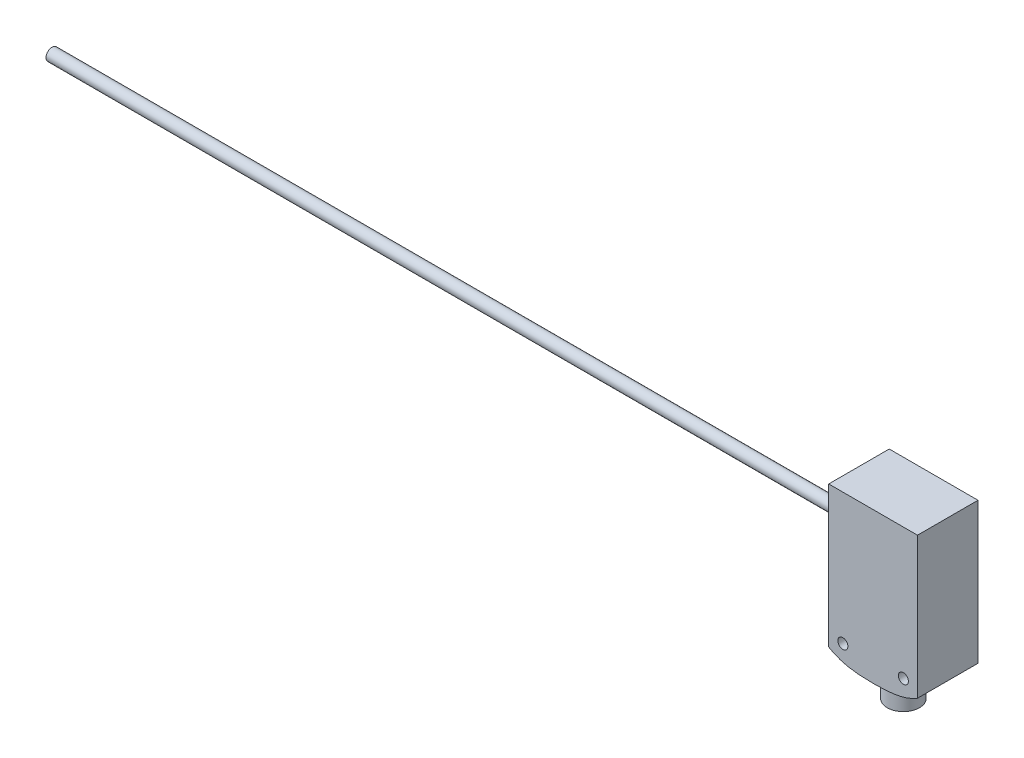
from build123d import *

# Parameters (mm, degrees)
ESQUISSE1_W             = 22
ESQUISSE1_H             = 44.3
ESQUISSE1_R             = 1.25
BOSS_EXTRU_1_DEPTH      = 15
ENL_V_MAT_EXTRU_1_DEPTH = 49.046748069
BOSS_EXTRU_2_REACH      = 50.047
ESQUISSE3_R             = 4
ENL_V_MAT_EXTRU_2_DEPTH = 0.1
ESQUISSE5_R             = 1.5
BOSS_EXTRU_3_DEPTH      = 200


with BuildPart() as part:
    # Esquisse1 → Boss.-Extru.1 (new body)
    with BuildSketch(Plane.XY):
        with Locations((0, 22.15)):
            Rectangle(ESQUISSE1_W, ESQUISSE1_H)
        with Locations((7.5, 11.8)):
            Circle(ESQUISSE1_R, mode=Mode.SUBTRACT)
        with Locations(Location((-7.5, 11.8, 0), (0, 0, 180))):
            Circle(ESQUISSE1_R, mode=Mode.SUBTRACT)
    extrude(amount=BOSS_EXTRU_1_DEPTH)

    # Esquisse2 → Enlèv. mat.-Extru.1 (cut, through all)
    with BuildSketch(Plane.XY.offset(15)):
        with BuildLine():
            Line((-11, 9.3), (-11, 0))
            Line((-11, 0), (11, 0))
            Line((11, 0), (11, 9.3))
            add(Edge.make_bspline(
                [(-11, 9.3), (-7.625374572, 7.236730077), (0, 6.763269923), (7.625374572, 7.236730077), (11, 9.3)],
                knots=[0, 0, 0, 0, 0.5, 1, 1, 1, 1], degree=3))
        make_face()
    extrude(amount=-ENL_V_MAT_EXTRU_1_DEPTH, mode=Mode.SUBTRACT)

    # Esquisse3 → Boss.-Extru.2 (add, up to next)
    with BuildSketch(Plane(origin=(0, 0, 0), x_dir=(1, 0, 0), z_dir=(0, 1, 0)), mode=Mode.PRIVATE) as boss_extru_2_sk1:
        with Locations(Location((0, -7.5, 0), (0, 0, 90))):
            Circle(ESQUISSE3_R)
    boss_extru_2_tool1 = extrude(boss_extru_2_sk1.sketch, amount=BOSS_EXTRU_2_REACH, mode=Mode.PRIVATE) - part.part
    add(boss_extru_2_tool1.solids().sort_by_distance((0, 0, 7.5))[0])

    # Esquisse4 → Enlèv. mat.-Extru.2 (cut)
    with BuildSketch(Plane.ZY.offset(11)):
        with BuildLine():
            Line((1.3, 37.8), (13.7, 37.8))
            Line((13.7, 37.8), (13.7, 16.8))
            ThreePointArc((13.7, 16.8), (7.5, 15.814731131), (1.3, 16.8))
            Line((1.3, 16.8), (1.3, 37.8))
        make_face()
    extrude(amount=-ENL_V_MAT_EXTRU_2_DEPTH, mode=Mode.SUBTRACT)


with BuildPart() as body_2:
    # Esquisse5 → Boss.-Extru.3 (new body)
    with BuildSketch(Plane.ZY.offset(11)):
        with Locations((7.5, 32.8)):
            Circle(ESQUISSE5_R)
    extrude(amount=BOSS_EXTRU_3_DEPTH)


solid = Compound([part.part, body_2.part])
